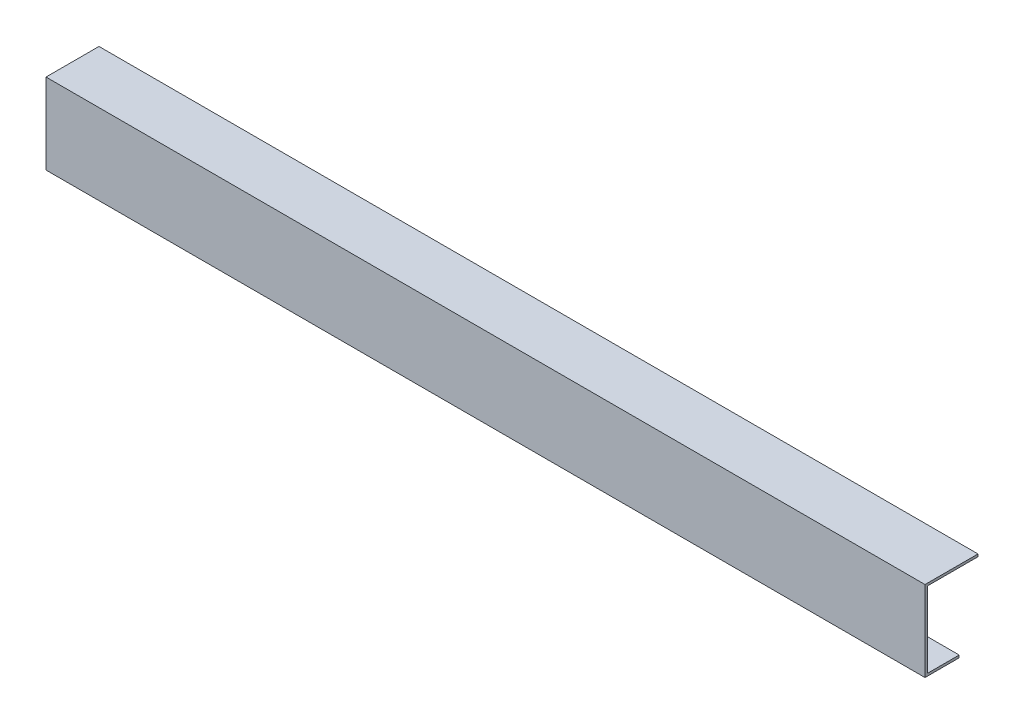
from build123d import *

# Parameters (mm, degrees)
SKETCH1_W           = 914.4
SKETCH1_H           = 83.82
BOSS_EXTRUDE1_DEPTH = 55.118
CUT_EXTRUDE1_DEPTH  = 920.886485564


with BuildPart() as part:
    # Sketch1 → Boss-Extrude1 (new body)
    with BuildSketch(Plane.XY):
        with Locations((457.2, -41.91)):
            Rectangle(SKETCH1_W, SKETCH1_H)
    extrude(amount=BOSS_EXTRUDE1_DEPTH)

    # Sketch2 → Cut-Extrude1 (cut, through all)
    with BuildSketch(Plane(origin=(914.4, 0, 0), x_dir=(0, 0, -1), z_dir=(1, 0, 0))):
        Polygon((-19.558, -83.82), (-19.558, -81.28), (-52.578, -81.28), (-52.578, -2.54), (0, -2.54), (0, -83.82), align=None)
    extrude(amount=-CUT_EXTRUDE1_DEPTH, mode=Mode.SUBTRACT)


solid = part.part
